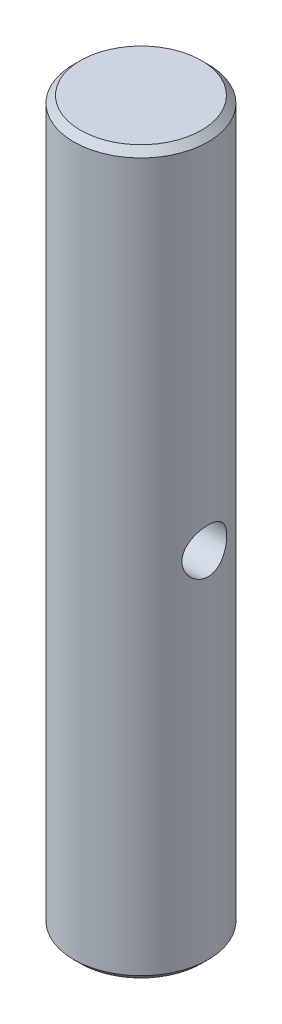
from build123d import *

# Parameters (mm, degrees)
SKETCH1_R               = 7.495
BOSS_EXTRUDE1_DEPTH     = 80.5
CUT_EXTRUDE1_DEPTH      = 82.194827729
CUT_EXTRUDE1_DEPTH_BACK = 82.194827729
SKETCH2_R               = 2.5
CHAMFER1_SIZE           = 0.75


with BuildPart() as part:
    # Sketch1 → Boss-Extrude1 (new body)
    with BuildSketch(Plane(origin=(0, 0, 0), x_dir=(1, 0, 0), z_dir=(0, 1, 0))):
        with Locations(Location((0, 0, 0), (0, 0, 270))):
            Circle(SKETCH1_R)
    extrude(amount=BOSS_EXTRUDE1_DEPTH)

    # Sketch2 → Cut-Extrude1 (cut, two sides: drawn at the far end of the back side and taken through both)
    with BuildSketch(Plane(origin=(0, 0, 0), x_dir=(0, 0, -1), z_dir=(1, 0, 0)).offset(-CUT_EXTRUDE1_DEPTH_BACK)):
        with Locations((0, 40.25)):
            Circle(SKETCH2_R)
    extrude(amount=CUT_EXTRUDE1_DEPTH + CUT_EXTRUDE1_DEPTH_BACK, mode=Mode.SUBTRACT)

    # Chamfer1
    chamfer1_edges = [part.edges().sort_by_distance(p)[0] for p in [
        (0, 0, -7.495),
        (0, 80.5, -7.495),
    ]]
    chamfer(chamfer1_edges, length=CHAMFER1_SIZE)


solid = part.part
